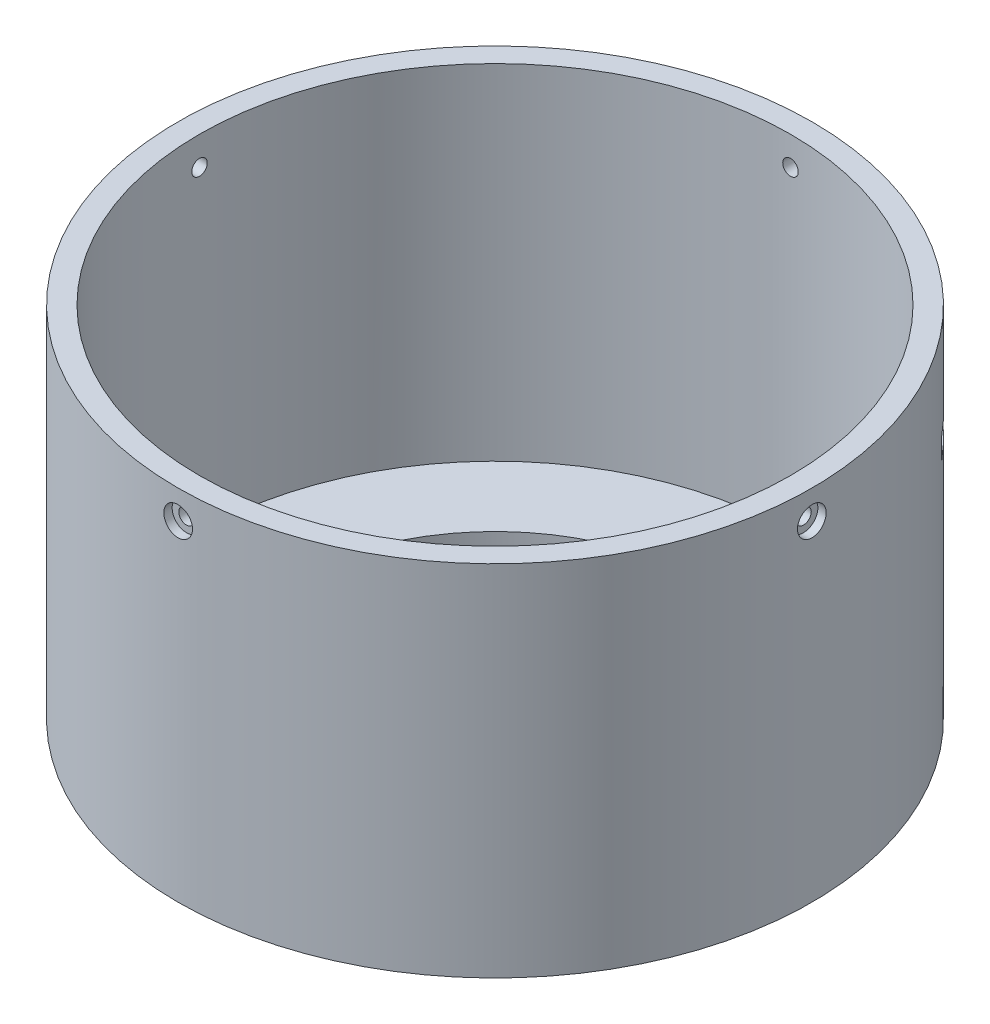
from build123d import *

# Parameters (mm, degrees)
SCHIZZO1_R                                           = 110.5
SCHIZZO1_R_2                                         = 103
ESTRUSIONE_ESTRUSIONE1_DEPTH                         = 125
FORO_LAMATO_PER_BULLONE_M12_A_TESTA_ESAG_D           = 5.4
FORO_LAMATO_PER_BULLONE_M12_A_TESTA_ESAG_DEPTH       = 8.1
FORO_LAMATO_PER_BULLONE_M12_A_TESTA_ESAG_CBORE_D     = 10
FORO_LAMATO_PER_BULLONE_M12_A_TESTA_ESAG_CBORE_DEPTH = 3
FORO_LAMATO_PER_BULLONE_M12_A_TESTA_ESAG_TIP         = 1.622323671
FORO_LAMATO_PER_BULLONE_M12_A_TESTA_2_D              = 5.4
FORO_LAMATO_PER_BULLONE_M12_A_TESTA_2_DEPTH          = 8.1
FORO_LAMATO_PER_BULLONE_M12_A_TESTA_2_CBORE_D        = 10
FORO_LAMATO_PER_BULLONE_M12_A_TESTA_2_CBORE_DEPTH    = 3
FORO_LAMATO_PER_BULLONE_M12_A_TESTA_2_TIP            = 1.622323671
FORO_LAMATO_PER_BULLONE_M12_A_TESTA_3_D              = 5.4
FORO_LAMATO_PER_BULLONE_M12_A_TESTA_3_DEPTH          = 8.1
FORO_LAMATO_PER_BULLONE_M12_A_TESTA_3_CBORE_D        = 10
FORO_LAMATO_PER_BULLONE_M12_A_TESTA_3_CBORE_DEPTH    = 3
FORO_LAMATO_PER_BULLONE_M12_A_TESTA_3_TIP            = 1.622323671
FORO_LAMATO_PER_BULLONE_M12_A_TESTA_4_D              = 5.4
FORO_LAMATO_PER_BULLONE_M12_A_TESTA_4_DEPTH          = 8.1
FORO_LAMATO_PER_BULLONE_M12_A_TESTA_4_CBORE_D        = 10
FORO_LAMATO_PER_BULLONE_M12_A_TESTA_4_CBORE_DEPTH    = 3
FORO_LAMATO_PER_BULLONE_M12_A_TESTA_4_TIP            = 1.622323671
SCHIZZO4_R                                           = 103
SCHIZZO4_R_2                                         = 73
ESTRUSIONE_ESTRUSIONE2_DEPTH                         = 5
FORO_PER_VITE_M6_1_D                                 = 6.6
SCHIZZO7_W                                           = 7.25
SCHIZZO7_H                                           = 20
TAGLIO_ESTRUSIONE1_DEPTH                             = 10


with BuildPart() as part:
    # Schizzo1 → Estrusione-Estrusione1 (new body)
    with BuildSketch(Plane(origin=(0, 0, 0), x_dir=(1, 0, 0), z_dir=(0, 1, 0))):
        with Locations(Location((0, 0, 0), (0, 0, 270))):
            Circle(SCHIZZO1_R)
        with Locations(Location((0, 0, 0), (0, 0, 270))):
            Circle(SCHIZZO1_R_2, mode=Mode.SUBTRACT)
    extrude(amount=ESTRUSIONE_ESTRUSIONE1_DEPTH)

    # Foro lamato per Bullone M12 a testa esagonale (Classe superiore)-1
    with Locations(Plane(origin=(0, 115, 110.5), x_dir=(1, 0, 0), z_dir=(0, 0, 1))):
        with Locations((0, 0)):
            CounterBoreHole(FORO_LAMATO_PER_BULLONE_M12_A_TESTA_ESAG_D / 2, FORO_LAMATO_PER_BULLONE_M12_A_TESTA_ESAG_CBORE_D / 2, FORO_LAMATO_PER_BULLONE_M12_A_TESTA_ESAG_CBORE_DEPTH, depth=FORO_LAMATO_PER_BULLONE_M12_A_TESTA_ESAG_DEPTH)
            with Locations((0, 0, -(FORO_LAMATO_PER_BULLONE_M12_A_TESTA_ESAG_DEPTH + FORO_LAMATO_PER_BULLONE_M12_A_TESTA_ESAG_TIP / 2))):  # 118° drill point
                Cone(0, FORO_LAMATO_PER_BULLONE_M12_A_TESTA_ESAG_D / 2, FORO_LAMATO_PER_BULLONE_M12_A_TESTA_ESAG_TIP, mode=Mode.SUBTRACT)

    # Foro lamato per Bullone M12 a testa  2
    with Locations(Plane(origin=(110.5, 115, 0), x_dir=(0, 0, 1), z_dir=(1, 0, 0))):
        with Locations((0, 0)):
            CounterBoreHole(FORO_LAMATO_PER_BULLONE_M12_A_TESTA_2_D / 2, FORO_LAMATO_PER_BULLONE_M12_A_TESTA_2_CBORE_D / 2, FORO_LAMATO_PER_BULLONE_M12_A_TESTA_2_CBORE_DEPTH, depth=FORO_LAMATO_PER_BULLONE_M12_A_TESTA_2_DEPTH)
            with Locations((0, 0, -(FORO_LAMATO_PER_BULLONE_M12_A_TESTA_2_DEPTH + FORO_LAMATO_PER_BULLONE_M12_A_TESTA_2_TIP / 2))):  # 118° drill point
                Cone(0, FORO_LAMATO_PER_BULLONE_M12_A_TESTA_2_D / 2, FORO_LAMATO_PER_BULLONE_M12_A_TESTA_2_TIP, mode=Mode.SUBTRACT)

    # Foro lamato per Bullone M12 a testa  3
    with Locations(Plane(origin=(0, 115, -110.5), x_dir=(-1, 0, 0), z_dir=(0, 0, -1))):
        with Locations((0, 0)):
            CounterBoreHole(FORO_LAMATO_PER_BULLONE_M12_A_TESTA_3_D / 2, FORO_LAMATO_PER_BULLONE_M12_A_TESTA_3_CBORE_D / 2, FORO_LAMATO_PER_BULLONE_M12_A_TESTA_3_CBORE_DEPTH, depth=FORO_LAMATO_PER_BULLONE_M12_A_TESTA_3_DEPTH)
            with Locations((0, 0, -(FORO_LAMATO_PER_BULLONE_M12_A_TESTA_3_DEPTH + FORO_LAMATO_PER_BULLONE_M12_A_TESTA_3_TIP / 2))):  # 118° drill point
                Cone(0, FORO_LAMATO_PER_BULLONE_M12_A_TESTA_3_D / 2, FORO_LAMATO_PER_BULLONE_M12_A_TESTA_3_TIP, mode=Mode.SUBTRACT)

    # Foro lamato per Bullone M12 a testa  4
    with Locations(Plane(origin=(-110.5, 115, 0), x_dir=(0, 0, -1), z_dir=(-1, 0, 0))):
        with Locations((0, 0)):
            CounterBoreHole(FORO_LAMATO_PER_BULLONE_M12_A_TESTA_4_D / 2, FORO_LAMATO_PER_BULLONE_M12_A_TESTA_4_CBORE_D / 2, FORO_LAMATO_PER_BULLONE_M12_A_TESTA_4_CBORE_DEPTH, depth=FORO_LAMATO_PER_BULLONE_M12_A_TESTA_4_DEPTH)
            with Locations((0, 0, -(FORO_LAMATO_PER_BULLONE_M12_A_TESTA_4_DEPTH + FORO_LAMATO_PER_BULLONE_M12_A_TESTA_4_TIP / 2))):  # 118° drill point
                Cone(0, FORO_LAMATO_PER_BULLONE_M12_A_TESTA_4_D / 2, FORO_LAMATO_PER_BULLONE_M12_A_TESTA_4_TIP, mode=Mode.SUBTRACT)

    # Schizzo4 → Estrusione-Estrusione2 (add)
    with BuildSketch(Plane.XZ):
        with Locations(Location((0, 0, 0), (0, 0, 270))):
            Circle(SCHIZZO4_R)
        with Locations(Location((0, 0, 0), (0, 0, 270))):
            Circle(SCHIZZO4_R_2, mode=Mode.SUBTRACT)
    extrude(amount=-ESTRUSIONE_ESTRUSIONE2_DEPTH)

    # Foro per Vite M6-1 (through all)
    with Locations(Plane(origin=(0, 5, 0), x_dir=(1, 0, 0), z_dir=(0, 1, 0))):
        with Locations((0, -88), (-88, 0), (88, 0), (0, 88)):
            Hole(FORO_PER_VITE_M6_1_D / 2)

    # Schizzo7 → Taglio-Estrusione1 (cut)
    with BuildSketch(Plane(origin=(78.135299321, 0, -78.135299321), x_dir=(0, -1, 0), z_dir=(0.7071067811865488, 0, -0.7071067811865464))):
        with Locations((-88.625, 0)):
            Rectangle(SCHIZZO7_W, SCHIZZO7_H)
    extrude(amount=-TAGLIO_ESTRUSIONE1_DEPTH, mode=Mode.SUBTRACT)


solid = part.part
